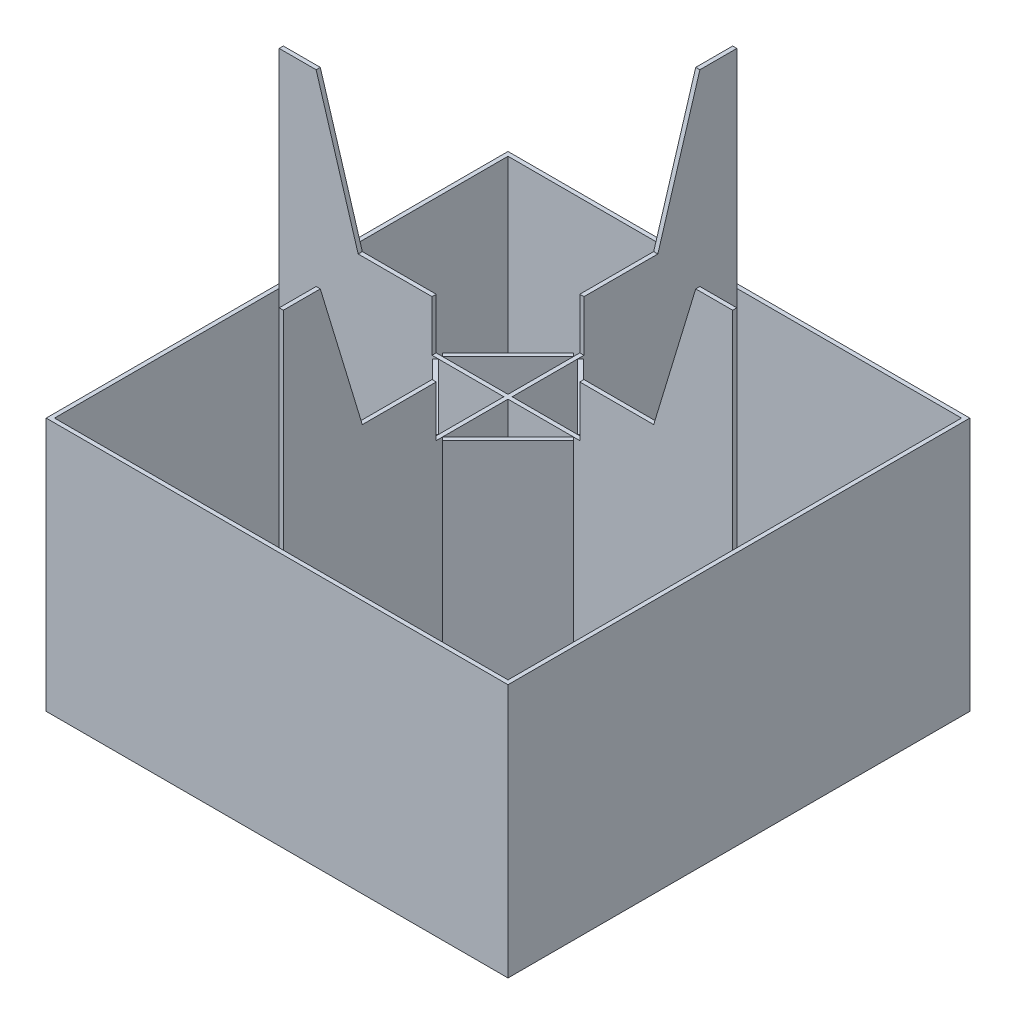
from build123d import *

# Parameters (mm, degrees)
SKETCH1_W             = 500
SKETCH1_H             = 500
SKETCH1_W_2           = 243.25
SKETCH1_H_2           = 243.25
BOSS_EXTRUDE1_DEPTH   = 500
BOSS_EXTRUDE3_DEPTH   = 500
BOSS_EXTRUDE3_2_DEPTH = 500
SKETCH8_W             = 500
SKETCH8_H             = 500
SKETCH8_W_2           = 491
SKETCH8_H_2           = 491
CUT_EXTRUDE1_DEPTH    = 225


with BuildPart() as part:
    # Sketch1 → Boss-Extrude1 (new body)
    with BuildSketch(Plane(origin=(0, 0, 0), x_dir=(1, 0, 0), z_dir=(0, 1, 0))):
        Rectangle(SKETCH1_W, SKETCH1_H)
        with Locations((-123.875, 123.875)):
            Rectangle(SKETCH1_W_2, SKETCH1_H_2, mode=Mode.SUBTRACT)
        with Locations((123.875, 123.875)):
            Rectangle(SKETCH1_W_2, SKETCH1_H_2, mode=Mode.SUBTRACT)
        with Locations((-123.875, -123.875)):
            Rectangle(SKETCH1_W_2, SKETCH1_H_2, mode=Mode.SUBTRACT)
        with Locations((123.875, -123.875)):
            Rectangle(SKETCH1_W_2, SKETCH1_H_2, mode=Mode.SUBTRACT)
    extrude(amount=BOSS_EXTRUDE1_DEPTH)

    # Sketch8 → Cut-Extrude1 (cut)
    with BuildSketch(Plane(origin=(0, 500, 0), x_dir=(1, 0, 0), z_dir=(0, 1, 0))):
        Rectangle(SKETCH8_W, SKETCH8_H)
        Rectangle(SKETCH8_W_2, SKETCH8_H_2, mode=Mode.SUBTRACT)
    extrude(amount=-CUT_EXTRUDE1_DEPTH, mode=Mode.SUBTRACT)


with BuildPart() as body_2:
    # Sketch4 → Boss-Extrude3 (new body)
    with BuildSketch(Plane(origin=(0, 500, 0), x_dir=(1, 0, 0), z_dir=(0, 1, 0))):
        Polygon((5.431980515, 76.142658634), (76.142658634, 5.431980515), (72.960678119, 2.25), (2.25, 72.960678119), align=None)
    extrude(amount=-BOSS_EXTRUDE3_DEPTH)


with BuildPart() as body_3:
    # Sketch4 → Boss-Extrude3 2 (new body)
    with BuildSketch(Plane(origin=(0, 500, 0), x_dir=(1, 0, 0), z_dir=(0, 1, 0))):
        Polygon((-76.142658634, 5.431980515), (-5.431980515, 76.142658634), (-2.25, 72.960678119), (-72.960678119, 2.25), align=None)
    extrude(amount=-BOSS_EXTRUDE3_2_DEPTH)


with BuildPart() as body_4:
    # Mirror2: mirrored copy
    add(body_3.part.mirror(Plane.XY))


with BuildPart() as body_5:
    # Mirror2 2: mirrored copy
    add(body_2.part.mirror(Plane.XY))


with BuildPart() as cut_revolve3_tool:
    # Sketch11 → Cut-Revolve3 (revolve)
    with BuildSketch(Plane.XY):
        Polygon((205.5, 500), (160, 350), (80, 350), (80, 295), (0, 295), (0, 500), align=None)
    revolve(axis=Axis((0, 500, 0), (0, -1, 0)))


with BuildPart() as part_1:
    add(part.part)

    # Cut-Revolve3: cut by cut_revolve3_tool
    add(cut_revolve3_tool.part, mode=Mode.SUBTRACT)


with BuildPart() as body_2_1:
    add(body_2.part)

    # Cut-Revolve3: cut by cut_revolve3_tool
    add(cut_revolve3_tool.part, mode=Mode.SUBTRACT)


with BuildPart() as body_3_1:
    add(body_3.part)

    # Cut-Revolve3: cut by cut_revolve3_tool
    add(cut_revolve3_tool.part, mode=Mode.SUBTRACT)


with BuildPart() as body_4_1:
    add(body_4.part)

    # Cut-Revolve3: cut by cut_revolve3_tool
    add(cut_revolve3_tool.part, mode=Mode.SUBTRACT)


with BuildPart() as body_5_1:
    add(body_5.part)

    # Cut-Revolve3: cut by cut_revolve3_tool
    add(cut_revolve3_tool.part, mode=Mode.SUBTRACT)


solid = Compound([part_1.part, body_2_1.part, body_3_1.part, body_4_1.part, body_5_1.part])
